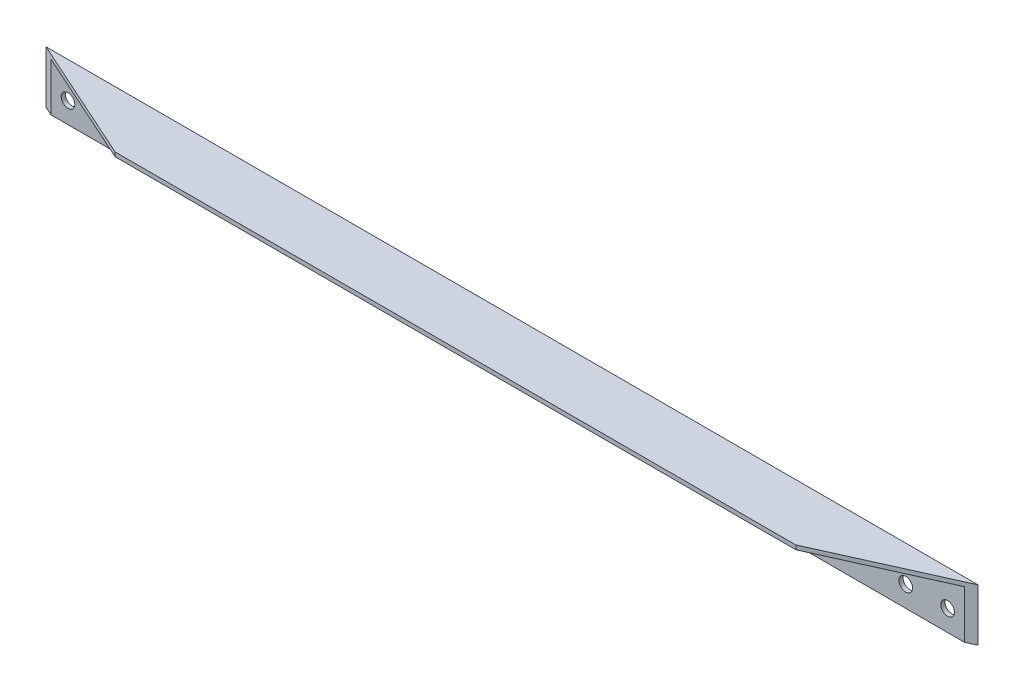
from build123d import *

# Parameters (mm, degrees)
SKETCH_1_W          = 1780
SKETCH_1_H          = 100
SKETCH_1_R          = 13
EXTRUDE_517_DEPTH   = 8
SKETCH_2_W          = 1780
SKETCH_2_H          = 8
EXTRUDE_1_DEPTH     = 100
CUT_EXTRUDE_1_DEPTH = 903.088687436


with BuildPart() as part:
    # 草图1 → Extrude 517 (new body)
    with BuildSketch(Plane.XY):
        with Locations((0, 50)):
            Rectangle(SKETCH_1_W, SKETCH_1_H)
        with Locations((840, 40)):
            Circle(SKETCH_1_R, mode=Mode.SUBTRACT)
        with Locations((760, 40)):
            Circle(SKETCH_1_R, mode=Mode.SUBTRACT)
        with Locations(Location((-840, 40, 0), (0, 0, 180))):
            Circle(SKETCH_1_R, mode=Mode.SUBTRACT)
        with Locations(Location((-760, 40, 0), (0, 0, 180))):
            Circle(SKETCH_1_R, mode=Mode.SUBTRACT)
    extrude(amount=EXTRUDE_517_DEPTH)

    # 草图2 → 凸台-拉伸1 (add)
    with BuildSketch(Plane.XY.offset(8)):
        with Locations((0, 96)):
            Rectangle(SKETCH_2_W, SKETCH_2_H)
    extrude(amount=EXTRUDE_1_DEPTH)

    # 草图3 → 切除-拉伸1 (cut, through all)
    with BuildSketch(Plane(origin=(0, 100, 0), x_dir=(-1, 0, 0), z_dir=(0, 1, 0))):
        Polygon((-650, 108), (-890, 0), (-890, 108), align=None)
        Polygon((890, 108), (650, 108), (890, 0), align=None)
    extrude(amount=-CUT_EXTRUDE_1_DEPTH, mode=Mode.SUBTRACT)


solid = part.part
